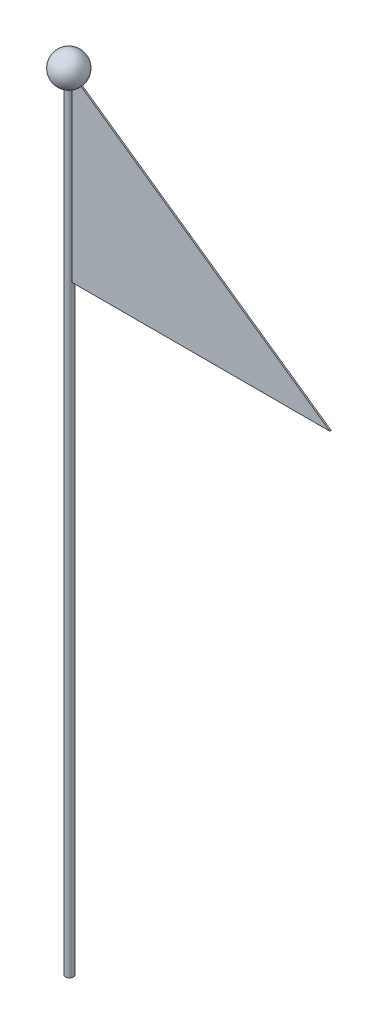
from build123d import *

# Parameters (mm, degrees)
BOSS_EXTRUDE1_DEPTH      = 0.5
BOSS_EXTRUDE1_DEPTH_BACK = 0.5
SKETCH2_R                = 3
BOSS_EXTRUDE2_DEPTH      = 600


with BuildPart() as part:
    # Sketch1 → Boss-Extrude1 (new, two sides: drawn at the far end of the back side and taken through both)
    with BuildSketch(Plane.XY.offset(-BOSS_EXTRUDE1_DEPTH_BACK)):
        Polygon((0, 0), (0, -140), (200, -140), align=None)
    extrude(amount=BOSS_EXTRUDE1_DEPTH + BOSS_EXTRUDE1_DEPTH_BACK)

    # Sketch2 → Boss-Extrude2 (add)
    with BuildSketch(Plane(origin=(0, 0, 0), x_dir=(1, 0, 0), z_dir=(0, 1, 0))):
        with Locations((0, 0.5)):
            Circle(SKETCH2_R)
    extrude(amount=-BOSS_EXTRUDE2_DEPTH)

    # Sketch3 → Revolve1 (revolve)
    with BuildSketch(Plane.XY):
        with BuildLine():
            Line((0, 12), (0, -12))
            ThreePointArc((0, -12), (-12, 0), (0, 12))
        make_face()
    revolve(axis=Axis((0, 12, 0), (0, -1, 0)))


solid = part.part
